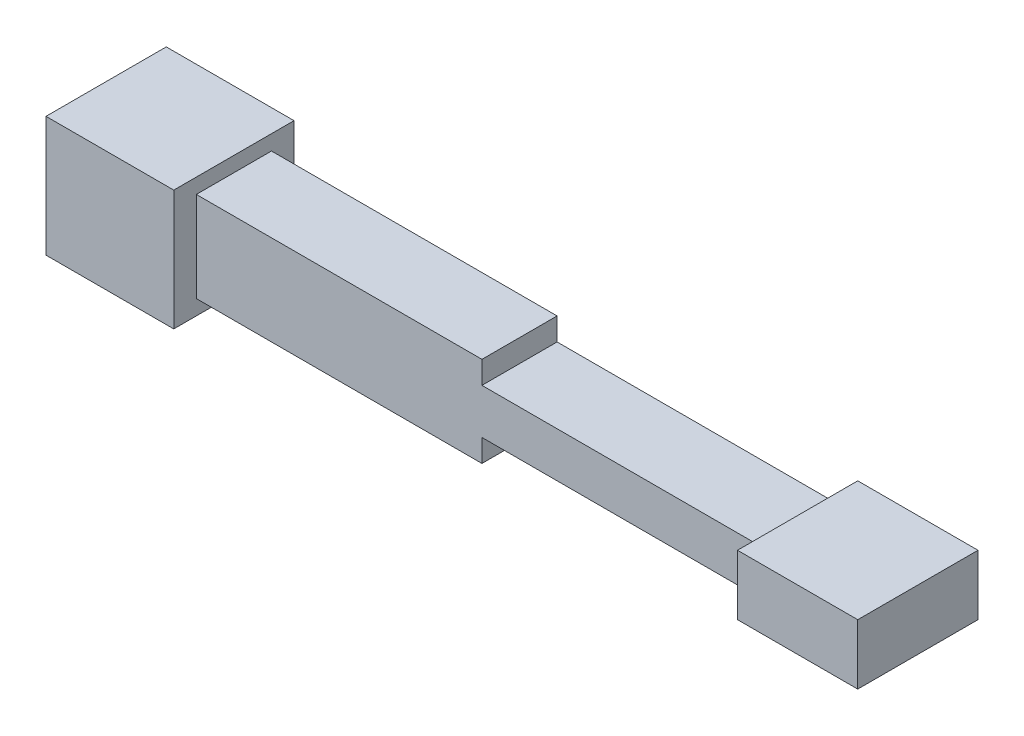
from build123d import *

# Parameters (mm, degrees)
SKETCH1_W             = 17
SKETCH1_H             = 16
BOSS_EXTRUDE1_DEPTH   = 8
SKETCH1_W_2           = 16
SKETCH1_H_2           = 8
BOSS_EXTRUDE1_2_DEPTH = 8
SKETCH1_3_W           = 37
SKETCH1_3_H           = 6
BOSS_EXTRUDE2_DEPTH   = 5


with BuildPart() as part:
    # Sketch1 → Boss-Extrude1 (new, symmetric)
    with BuildSketch(Plane.XY):
        with Locations((-45.5, 0)):
            Rectangle(SKETCH1_W, SKETCH1_H)
    extrude(amount=BOSS_EXTRUDE1_DEPTH, both=True)



with BuildPart() as body_2:
    # Sketch1 → Boss-Extrude1 2 (new, symmetric)
    with BuildSketch(Plane.XY):
        with Locations((46, 0)):
            Rectangle(SKETCH1_W_2, SKETCH1_H_2)
    extrude(amount=BOSS_EXTRUDE1_2_DEPTH, both=True)


with BuildPart() as part_1:
    add(part.part)

    add(body_2.part)  # Boss-Extrude2 merges body 2
    # Sketch1<3> → Boss-Extrude2 (add, symmetric)
    with BuildSketch(Plane.XY):
        Polygon((1, -6), (1, -3), (1, 3), (1, 6), (-37, 6), (-37, -6), align=None)
        with Locations((19.5, 0)):
            Rectangle(SKETCH1_3_W, SKETCH1_3_H)
    extrude(amount=BOSS_EXTRUDE2_DEPTH, both=True)


solid = part_1.part
